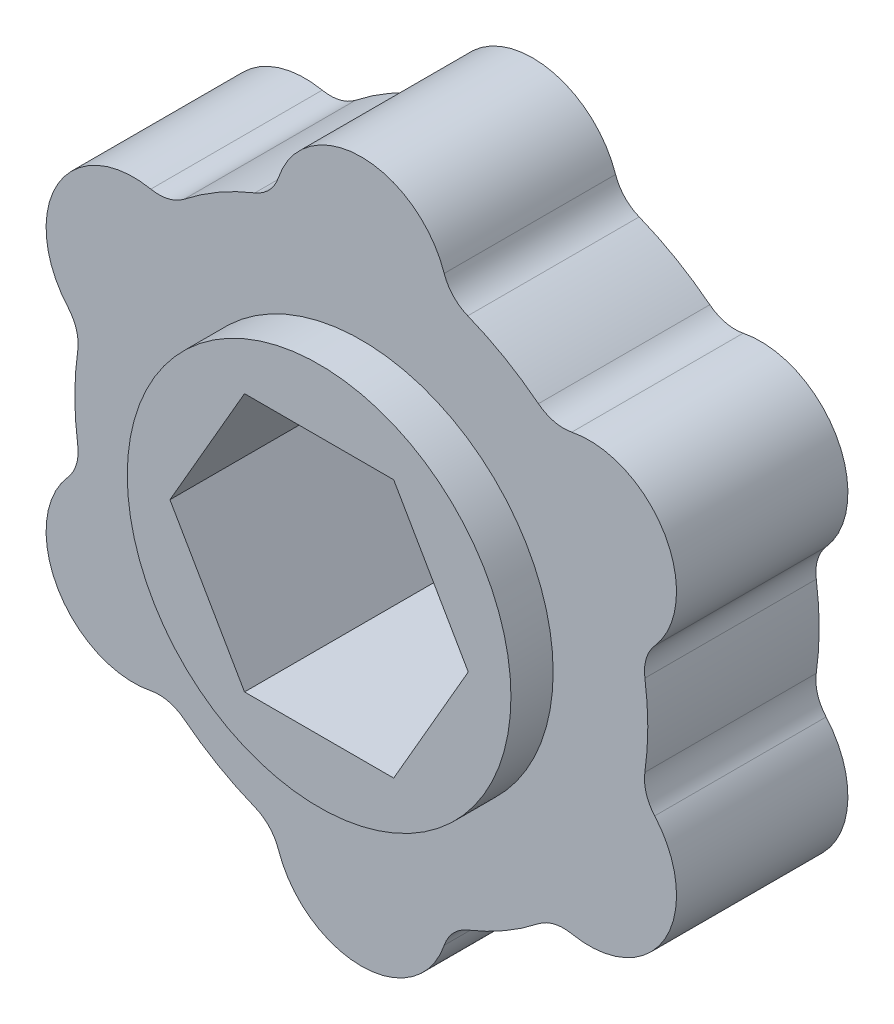
from build123d import *

# Parameters (mm, degrees)
BOSS_EXTRUDE2_DEPTH = 8.509
FILLET1_R           = 2.032
CUT_EXTRUDE1_DEPTH  = 25.900744443
SKETCH7_R           = 9.525
BOSS_EXTRUDE3_DEPTH = 1.0795
BOSS_EXTRUDE4_START = 2.0955
SKETCH8_R           = 9.525
BOSS_EXTRUDE4_DEPTH = 2.0955


with BuildPart() as part:
    # Sketch5 → Boss-Extrude2 (new body)
    with BuildSketch(Plane.XY):
        with BuildLine():
            ThreePointArc((13.895294195, 3.040226179), (15.067976, 8.6995), (9.580560202, 10.513564677))
            ThreePointArc((9.580560202, 10.513564677), (7.112, 12.318345343), (4.314733993, 13.553790856))
            ThreePointArc((4.314733993, 13.553790856), (0, 17.399), (-4.314733993, 13.553790856))
            ThreePointArc((-4.314733993, 13.553790856), (-7.112, 12.318345343), (-9.580560202, 10.513564677))
            ThreePointArc((-9.580560202, 10.513564677), (-15.067976, 8.6995), (-13.895294195, 3.040226179))
            ThreePointArc((-13.895294195, 3.040226179), (-14.224, 0), (-13.895294195, -3.040226179))
            ThreePointArc((-13.895294195, -3.040226179), (-15.067976, -8.6995), (-9.580560202, -10.513564677))
            ThreePointArc((-9.580560202, -10.513564677), (-7.112, -12.318345343), (-4.314733993, -13.553790856))
            ThreePointArc((-4.314733993, -13.553790856), (0, -17.399), (4.314733993, -13.553790856))
            ThreePointArc((4.314733993, -13.553790856), (7.112, -12.318345343), (9.580560202, -10.513564677))
            ThreePointArc((9.580560202, -10.513564677), (15.067976, -8.6995), (13.895294195, -3.040226179))
            ThreePointArc((13.895294195, -3.040226179), (14.224, 0), (13.895294195, 3.040226179))
        make_face()
    extrude(amount=BOSS_EXTRUDE2_DEPTH)

    # Fillet1
    fillet1_edges = [part.edges().sort_by_distance(p)[0] for p in [
        (-4.314733993, 13.553790856, 4.2545),
        (4.314733993, 13.553790856, 4.2545),
        (9.580560202, 10.513564677, 4.2545),
        (13.895294195, 3.040226179, 4.2545),
        (13.895294195, -3.040226179, 4.2545),
        (9.580560202, -10.513564677, 4.2545),
        (4.314733993, -13.553790856, 4.2545),
        (-4.314733993, -13.553790856, 4.2545),
        (-9.580560202, -10.513564677, 4.2545),
        (-13.895294195, -3.040226179, 4.2545),
        (-9.580560202, 10.513564677, 4.2545),
        (-13.895294195, 3.040226179, 4.2545),
    ]]
    fillet(fillet1_edges, radius=FILLET1_R)

    # Sketch6 → Cut-Extrude1 (cut, through all)
    with BuildSketch(Plane.XY.offset(8.509)):
        Polygon((7.405671903, 0), (3.702835951, 6.4135), (-3.702835951, 6.4135), (-7.405671903, 0), (-3.702835951, -6.4135), (3.702835951, -6.4135), align=None)
    extrude(amount=-CUT_EXTRUDE1_DEPTH, mode=Mode.SUBTRACT)

    # Sketch7 → Boss-Extrude3 (add)
    with BuildSketch(Plane(origin=(0, 0, 0), x_dir=(-1, 0, 0), z_dir=(0, 0, -1))):
        with Locations(Location((0, 0, 0), (0, 0, 180))):
            Circle(SKETCH7_R)
        Polygon((-7.405671903, 0), (-3.702835951, 6.4135), (3.702835951, 6.4135), (7.405671903, 0), (3.702835951, -6.4135), (-3.702835951, -6.4135), align=None, mode=Mode.SUBTRACT)
    extrude(amount=BOSS_EXTRUDE3_DEPTH)

    # Sketch8 → Boss-Extrude4 (add)
    with BuildSketch(Plane.XY.offset(8.509).offset(BOSS_EXTRUDE4_START)):
        Circle(SKETCH8_R)
        Polygon((3.702835951, -6.4135), (7.405671903, 0), (3.702835951, 6.4135), (-3.702835951, 6.4135), (-7.405671903, 0), (-3.702835951, -6.4135), align=None, mode=Mode.SUBTRACT)
    extrude(amount=-BOSS_EXTRUDE4_DEPTH)


solid = part.part
